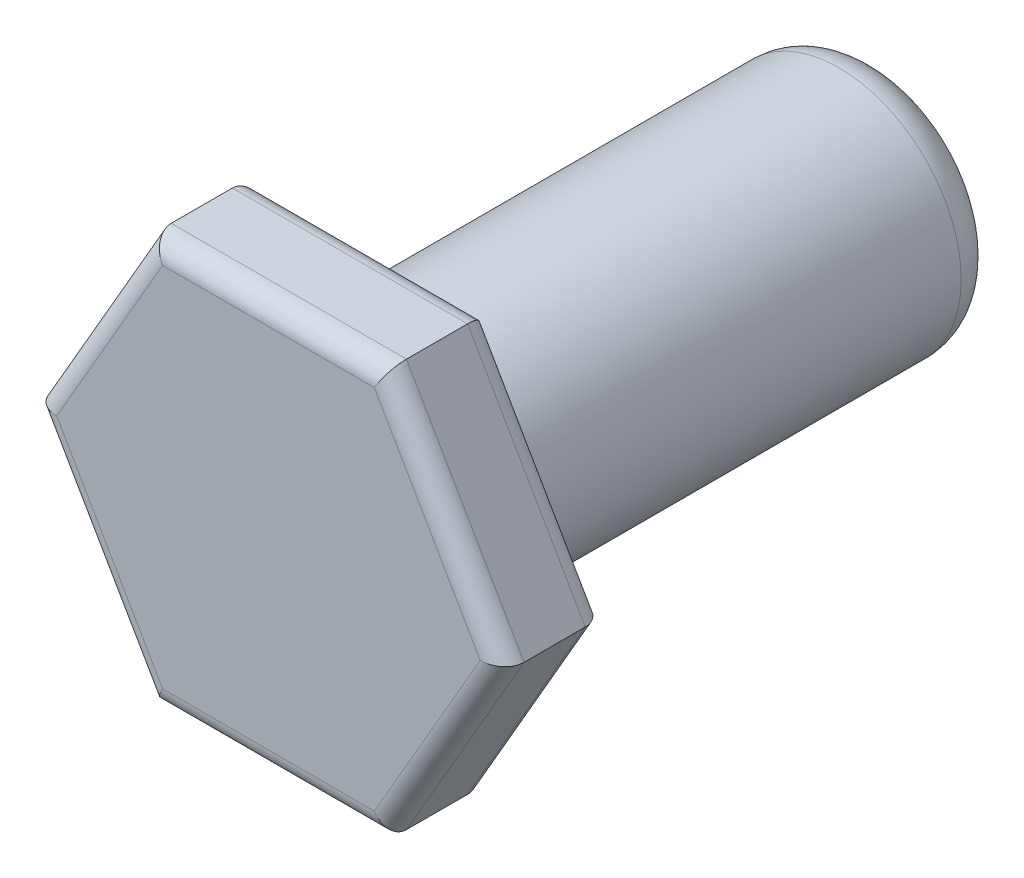
from build123d import *

# Parameters (mm, degrees)
SKETCH_1_R      = 6
EXTRUDE_1_DEPTH = 25
EXTRUDE_2_DEPTH = 5
FILLET_1_R      = 2
FILLET_2_R      = 1


with BuildPart() as part:
    # 草图1 → 凸台-拉伸1 (new body)
    with BuildSketch(Plane.XY):
        Circle(SKETCH_1_R)
    extrude(amount=EXTRUDE_1_DEPTH)

    # 草图2 → 凸台-拉伸2 (add)
    with BuildSketch(Plane.XY.offset(25)):
        Polygon((5.773502692, -10), (11.547005384, 0), (5.773502692, 10), (-5.773502692, 10), (-11.547005384, 0), (-5.773502692, -10), align=None)
    extrude(amount=EXTRUDE_2_DEPTH)

    # 圆角1
    fillet_1_edges = [part.edges().sort_by_distance(p)[0] for p in [
        (-6, 0, 0),
    ]]
    fillet(fillet_1_edges, radius=FILLET_1_R)

    # 圆角2
    fillet_2_edges = [part.edges().sort_by_distance(p)[0] for p in [
        (0, -10, 25),
        (8.660254038, -5, 25),
        (8.660254038, 5, 25),
        (0, 10, 25),
        (-8.660254038, 5, 25),
        (-8.660254038, -5, 25),
        (0, -10, 30),
        (8.660254038, -5, 30),
        (8.660254038, 5, 30),
        (0, 10, 30),
        (-8.660254038, 5, 30),
        (-8.660254038, -5, 30),
    ]]
    fillet(fillet_2_edges, radius=FILLET_2_R)


solid = part.part
